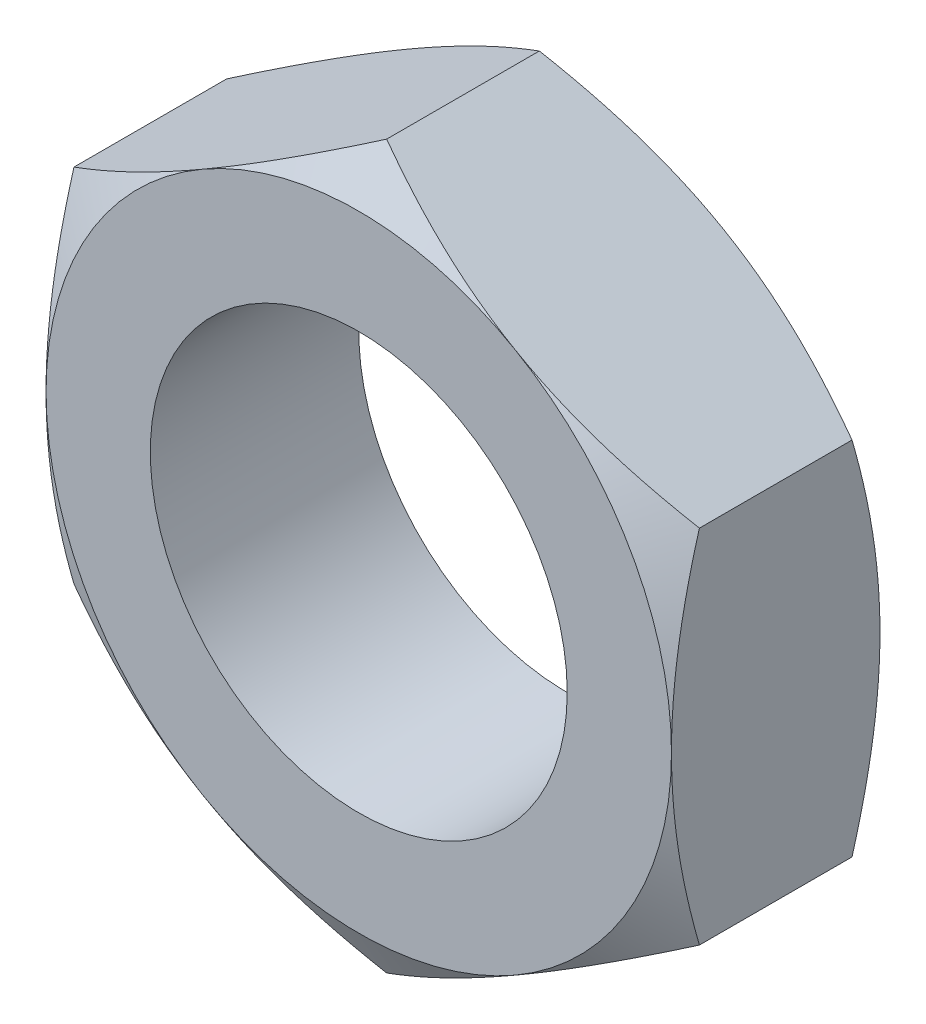
from build123d import *

# Parameters (mm, degrees)
SZKIC1_R                    = 9
DODANIE_WYCI_GNI_CIE1_DEPTH = 4.5
SZKIC2_OUTSIDE_W            = 68.62
SZKIC2_OUTSIDE_H            = 72.796
SZKIC2_OUTSIDE_R            = 13.5
WYTNIJ_WYCI_GNI_CIE2_DEPTH  = 9
WYTNIJ_WYCI_GNI_CIE2_DRAFT  = -60
LUSTRO1_COPY_1_SKETCH_W     = 68.62
LUSTRO1_COPY_1_SKETCH_H     = 72.796
LUSTRO1_COPY_1_SKETCH_R     = 13.5
LUSTRO1_COPY_1_DEPTH        = 9
LUSTRO1_COPY_1_DRAFT        = -60


with BuildPart() as part:
    # Szkic1 → Dodanie-wyciągnięcie1 (new, symmetric)
    with BuildSketch(Plane.XY):
        Polygon((-13.5, 7.794228634), (-13.5, -7.794228634), (0, -15.588457268), (13.5, -7.794228634), (13.5, 7.794228634), (0, 15.588457268), align=None)
        Circle(SZKIC1_R, mode=Mode.SUBTRACT)
    extrude(amount=DODANIE_WYCI_GNI_CIE1_DEPTH, both=True)


with BuildPart() as wytnij_wyci_gni_cie2_tool:
    # Szkic2 outside → Wytnij-wyciągnięcie2 (with draft: the straight prism first)
    with BuildSketch(Plane.XY.offset(4.5)):
        Rectangle(SZKIC2_OUTSIDE_W, SZKIC2_OUTSIDE_H)
        Circle(SZKIC2_OUTSIDE_R, mode=Mode.SUBTRACT)
    extrude(amount=-WYTNIJ_WYCI_GNI_CIE2_DEPTH)
    # Wytnij-wyciągnięcie2: the draft: its side faces are tilted about the plane it starts from
    wytnij_wyci_gni_cie2_sides = [wytnij_wyci_gni_cie2_tool.faces().sort_by_distance(p)[0] for p in [
        (0, -36.398, 0),
        (34.31, 0, 0),
        (0, 36.398, 0),
        (-34.31, 0, 0),
        (-13.5, 0, 0),
    ]]
    draft(wytnij_wyci_gni_cie2_sides, Plane.XY.offset(4.5), WYTNIJ_WYCI_GNI_CIE2_DRAFT)


with BuildPart() as part_1:
    add(part.part)

    # Wytnij-wyciągnięcie2: cut by wytnij_wyci_gni_cie2_tool
    add(wytnij_wyci_gni_cie2_tool.part, mode=Mode.SUBTRACT)


with BuildPart() as lustro1_copy_1_tool:
    # Lustro1 copy 1 sketch → Lustro1 copy 1 (with draft: the straight prism first)
    with BuildSketch(Plane(origin=(0, 0, -4.5), x_dir=(1, 0, 0), z_dir=(0, 0, -1))):
        Rectangle(LUSTRO1_COPY_1_SKETCH_W, LUSTRO1_COPY_1_SKETCH_H)
        Circle(LUSTRO1_COPY_1_SKETCH_R, mode=Mode.SUBTRACT)
    extrude(amount=-LUSTRO1_COPY_1_DEPTH)
    # Lustro1 copy 1: the draft: its side faces are tilted about the plane it starts from
    lustro1_copy_1_sides = [lustro1_copy_1_tool.faces().sort_by_distance(p)[0] for p in [
        (0, -36.398, 0),
        (34.31, 0, 0),
        (0, 36.398, 0),
        (-34.31, 0, 0),
        (-13.5, 0, 0),
    ]]
    draft(lustro1_copy_1_sides, Plane(origin=(0, 0, -4.5), x_dir=(1, 0, 0), z_dir=(0, 0, -1)), LUSTRO1_COPY_1_DRAFT)


with BuildPart() as part_2:
    add(part_1.part)

    # Lustro1 copy 1: cut by lustro1_copy_1_tool
    add(lustro1_copy_1_tool.part, mode=Mode.SUBTRACT)


solid = part_2.part
